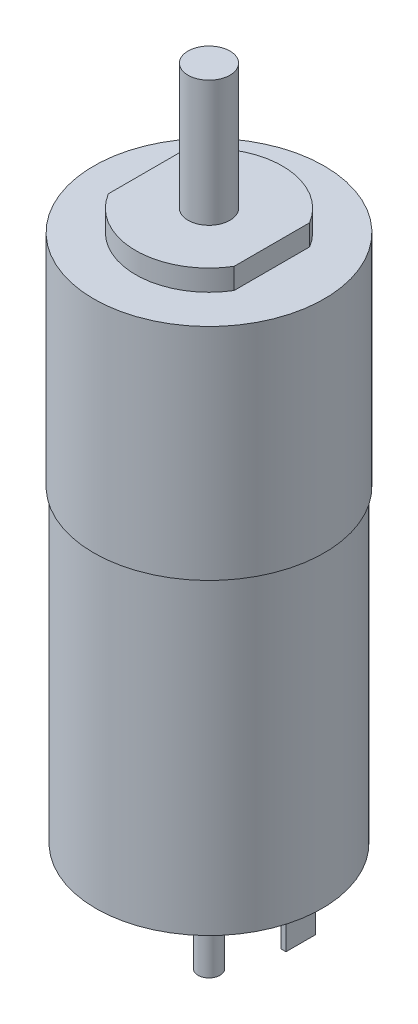
from build123d import *

# Parameters (mm, degrees)
SKETCH2_R           = 10.8
BOSS_EXTRUDE1_DEPTH = 29.5
SKETCH3_R           = 11
BOSS_EXTRUDE2_DEPTH = 21
BOSS_EXTRUDE3_DEPTH = 2
SKETCH5_R           = 2
BOSS_EXTRUDE4_DEPTH = 12
SKETCH6_R           = 3.75
BOSS_EXTRUDE5_DEPTH = 2
SKETCH7_W           = 0.5
SKETCH7_H           = 2.8
BOSS_EXTRUDE6_DEPTH = 3.9
SKETCH8_R           = 1.05
BOSS_EXTRUDE7_DEPTH = 8.4


with BuildPart() as part:
    # Sketch2 → Boss-Extrude1 (new body)
    with BuildSketch(Plane(origin=(0, 0, 0), x_dir=(1, 0, 0), z_dir=(0, 1, 0))):
        with Locations(Location((0, 0, 0), (0, 0, 270))):
            Circle(SKETCH2_R)
    extrude(amount=BOSS_EXTRUDE1_DEPTH)

    # Sketch3 → Boss-Extrude2 (add)
    with BuildSketch(Plane(origin=(0, 29.5, 0), x_dir=(1, 0, 0), z_dir=(0, 1, 0))):
        with Locations(Location((0, 0, 0), (0, 0, 90))):
            Circle(SKETCH3_R)
    extrude(amount=BOSS_EXTRUDE2_DEPTH)

    # Sketch4 → Boss-Extrude3 (add)
    with BuildSketch(Plane(origin=(0, 50.5, 0), x_dir=(1, 0, 0), z_dir=(0, 1, 0))):
        with BuildLine():
            Line((6, 3.605551275), (6, -3.605551275))
            ThreePointArc((6, -3.605551275), (0, -7), (-6, -3.605551275))
            Line((-6, -3.605551275), (-6, 3.605551275))
            ThreePointArc((-6, 3.605551275), (0, 7), (6, 3.605551275))
        make_face()
    extrude(amount=BOSS_EXTRUDE3_DEPTH)

    # Sketch5 → Boss-Extrude4 (add)
    with BuildSketch(Plane(origin=(0, 52.5, 0), x_dir=(1, 0, 0), z_dir=(0, 1, 0))):
        with Locations(Location((0, 0, 0), (0, 0, 270))):
            Circle(SKETCH5_R)
    extrude(amount=BOSS_EXTRUDE4_DEPTH)

    # Sketch6 → Boss-Extrude5 (add)
    with BuildSketch(Plane.XZ):
        with Locations(Location((0, 0, 0), (0, 0, 270))):
            Circle(SKETCH6_R)
    extrude(amount=BOSS_EXTRUDE5_DEPTH)

    # Sketch7 → Boss-Extrude6 (add)
    with BuildSketch(Plane.XZ):
        with Locations((-8.5, 0)):
            Rectangle(SKETCH7_W, SKETCH7_H)
        with Locations((8.5, 0)):
            Rectangle(SKETCH7_W, SKETCH7_H)
    extrude(amount=BOSS_EXTRUDE6_DEPTH)

    # Sketch8 → Boss-Extrude7 (add)
    with BuildSketch(Plane.XZ.offset(2)):
        with Locations(Location((0, 0, 0), (0, 0, 270))):
            Circle(SKETCH8_R)
    extrude(amount=BOSS_EXTRUDE7_DEPTH)


solid = part.part
